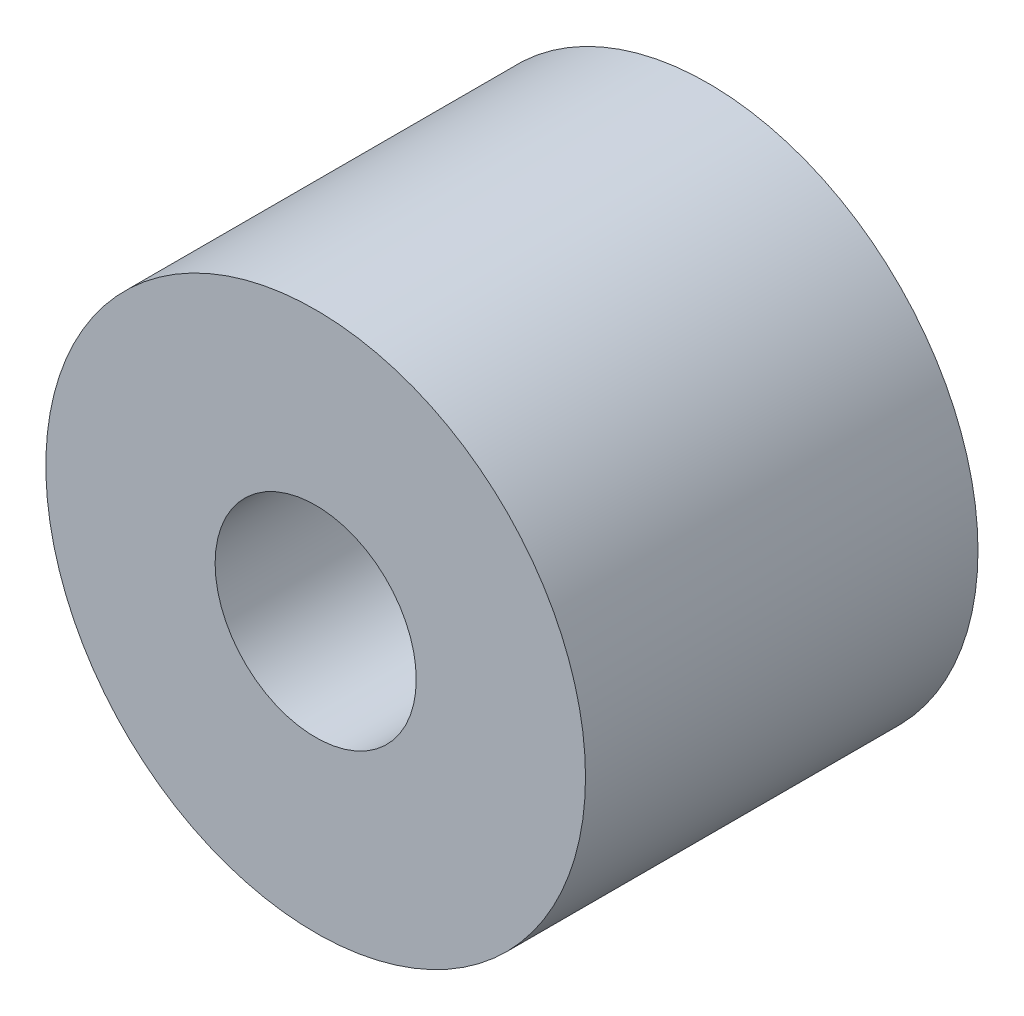
from build123d import *

# Parameters (mm, degrees)
SKETCH1_R           = 5.5
SKETCH1_R_2         = 2.05
BOSS_EXTRUDE1_DEPTH = 8


with BuildPart() as part:
    # Sketch1 → Boss-Extrude1 (new body)
    with BuildSketch(Plane.XY):
        Circle(SKETCH1_R)
        Circle(SKETCH1_R_2, mode=Mode.SUBTRACT)
    extrude(amount=BOSS_EXTRUDE1_DEPTH)


solid = part.part
